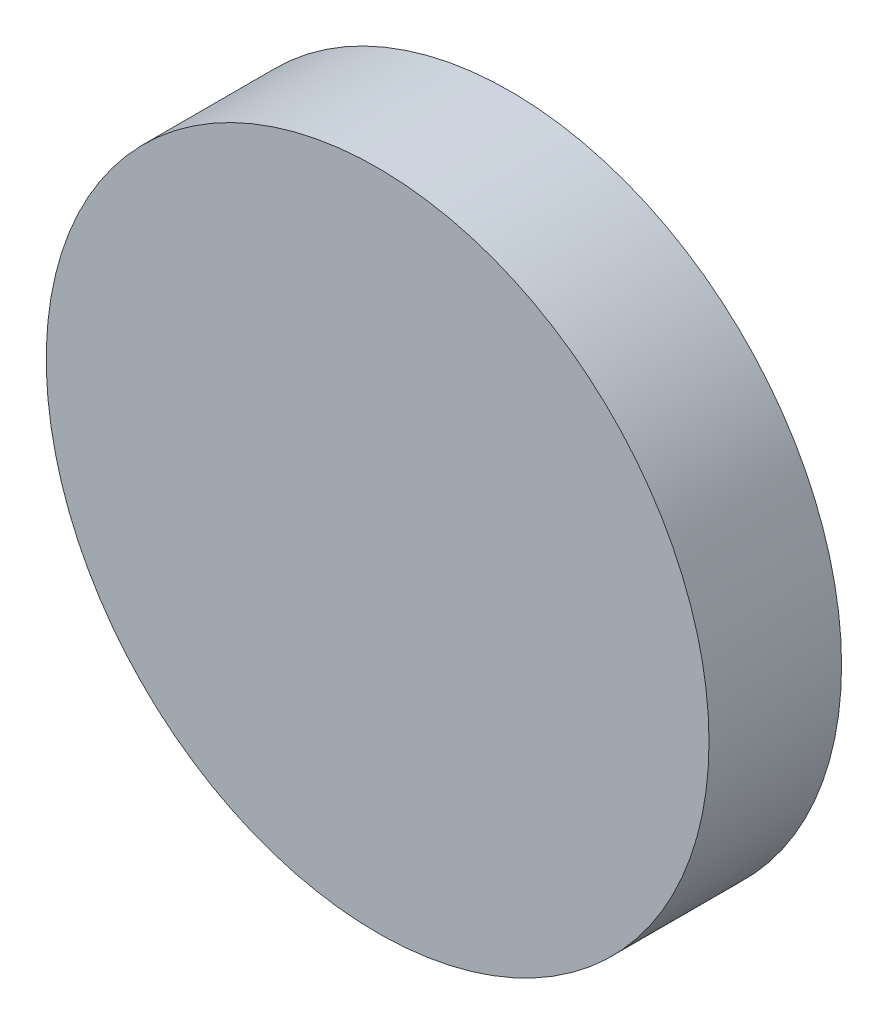
from build123d import *

# Parameters (mm, degrees)
SKETCH1_R           = 31.75
BOSS_EXTRUDE1_DEPTH = 6.35


with BuildPart() as part:
    # Sketch1 → Boss-Extrude1 (new, symmetric)
    with BuildSketch(Plane.XY):
        Circle(SKETCH1_R)
    extrude(amount=BOSS_EXTRUDE1_DEPTH, both=True)


solid = part.part
